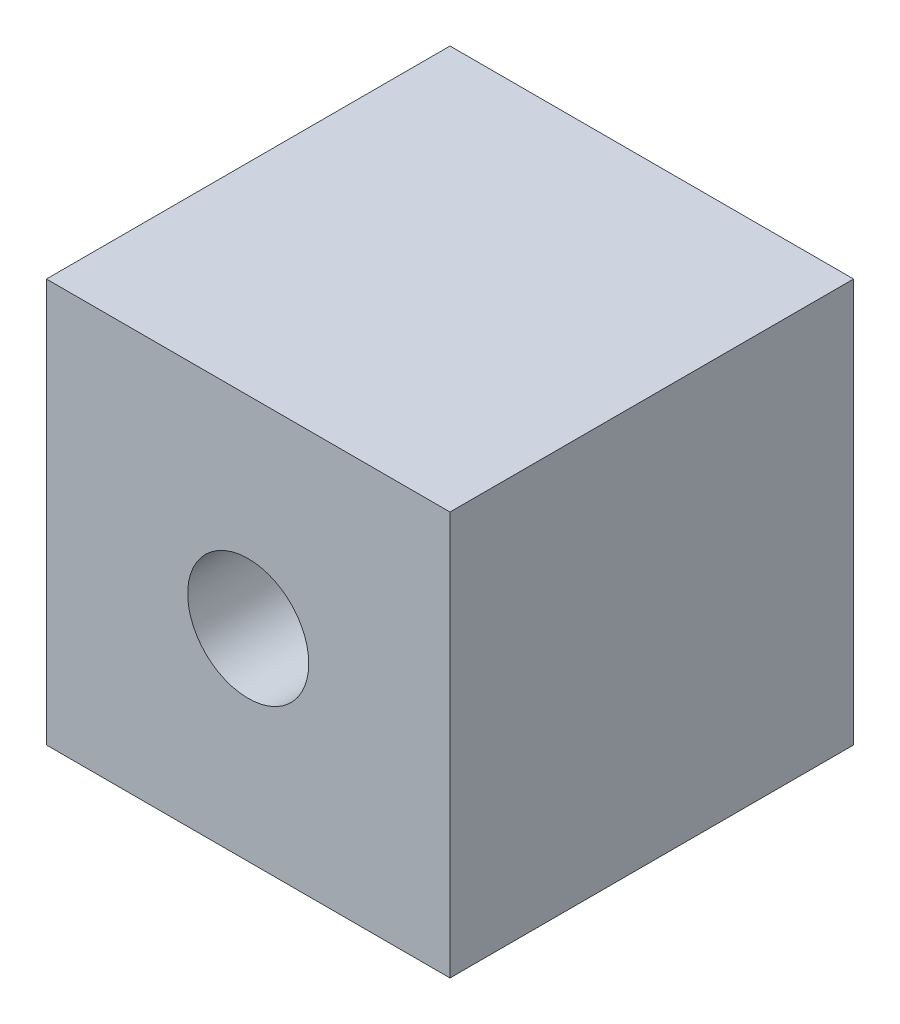
from build123d import *

# Parameters (mm, degrees)
SKETCH1_W           = 10
SKETCH1_H           = 10
BOSS_EXTRUDE1_DEPTH = 10
SKETCH2_R           = 1.5
CUT_EXTRUDE2_DEPTH  = 18.320508076


with BuildPart() as part:
    # Sketch1 → Boss-Extrude1 (new body)
    with BuildSketch(Plane.XY):
        with Locations((5, 5)):
            Rectangle(SKETCH1_W, SKETCH1_H)
    extrude(amount=BOSS_EXTRUDE1_DEPTH)

    # Sketch2 → Cut-Extrude2 (cut, through all)
    with BuildSketch(Plane.XY):
        with Locations((5, 5)):
            Circle(SKETCH2_R)
    extrude(amount=CUT_EXTRUDE2_DEPTH, mode=Mode.SUBTRACT)


solid = part.part
